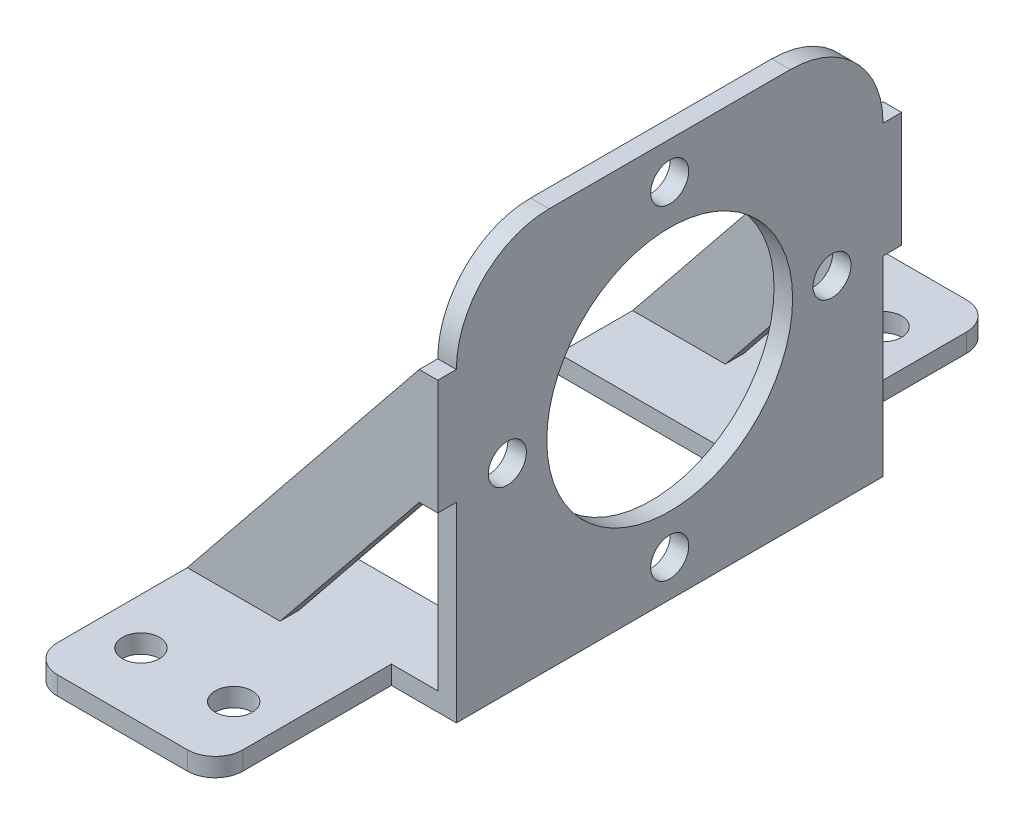
from build123d import *

# Parameters (mm, degrees)
SKETCH1_R           = 13.25
SKETCH1_R_2         = 2.05
BOSS_EXTRUDE1_DEPTH = 2
SKETCH2_R           = 2
BOSS_EXTRUDE2_DEPTH = 2
BOSS_EXTRUDE3_DEPTH = 2
BOSS_EXTRUDE4_DEPTH = 2
SKETCH5_W           = 7
SKETCH5_H           = 5
CUT_EXTRUDE1_DEPTH  = 2
SKETCH6_W           = 20
SKETCH6_H           = 5
CUT_EXTRUDE2_DEPTH  = 2
FILLET1_R           = 3
SKETCH8_W           = 25
SKETCH8_H           = 8
BOSS_EXTRUDE5_DEPTH = 2


with BuildPart() as part:
    # Sketch1 → Boss-Extrude1 (new body)
    with BuildSketch(Plane(origin=(0, 0, 0), x_dir=(0, 0, -1), z_dir=(1, 0, 0))):
        with BuildLine():
            Line((-13, 21.5), (13, 21.5))
            ThreePointArc((13, 21.5), (20.071067812, 18.571067812), (23, 11.5))
            Line((23, 11.5), (23, -21.5))
            Line((23, -21.5), (-23, -21.5))
            Line((-23, -21.5), (-23, 11.5))
            ThreePointArc((-23, 11.5), (-20.071067812, 18.571067812), (-13, 21.5))
        make_face()
        Circle(SKETCH1_R, mode=Mode.SUBTRACT)
        with Locations((0, 17.5)):
            Circle(SKETCH1_R_2, mode=Mode.SUBTRACT)
        with Locations((17.5, 0)):
            Circle(SKETCH1_R_2, mode=Mode.SUBTRACT)
        with Locations((0, -17.5)):
            Circle(SKETCH1_R_2, mode=Mode.SUBTRACT)
        with Locations((-17.5, 0)):
            Circle(SKETCH1_R_2, mode=Mode.SUBTRACT)
    extrude(amount=BOSS_EXTRUDE1_DEPTH)

    # Sketch2 → Boss-Extrude2 (add)
    # profile 1 of 2: a face of its own
    with BuildSketch(Plane.XZ.offset(21.5)):
        Polygon((-5, 23), (-25, 23), (-25, 47), (-5, 47), (-5, 28), (2, 28), (2, 23), align=None)
        with Locations(Location((-20, 35, 0), (0, 0, 270))):
            Circle(SKETCH2_R, mode=Mode.SUBTRACT)
        with Locations(Location((-10, 35, 0), (0, 0, 90))):
            Circle(SKETCH2_R, mode=Mode.SUBTRACT)
    # profile 2 of 2: a face of its own
    with BuildSketch(Plane.XZ.offset(21.5)):
        Polygon((2, -23), (-5, -23), (-25, -23), (-25, -47), (-5, -47), (-5, -28), (2, -28), align=None)
        with Locations(Location((-10, -35, 0), (0, 0, 270))):
            Circle(SKETCH2_R, mode=Mode.SUBTRACT)
        with Locations(Location((-20, -35, 0), (0, 0, 90))):
            Circle(SKETCH2_R, mode=Mode.SUBTRACT)
    extrude(amount=-BOSS_EXTRUDE2_DEPTH)

    # Sketch3 → Boss-Extrude3 (add)
    with BuildSketch(Plane(origin=(0, 0, -23), x_dir=(-1, 0, 0), z_dir=(0, 0, -1))):
        Polygon((-2, 11.5), (0, 11.5), (25, -19.5), (15, -19.5), (0, -0.9), (-2, -0.9), align=None)
    extrude(amount=BOSS_EXTRUDE3_DEPTH)

    # Sketch4 → Boss-Extrude4 (add)
    with BuildSketch(Plane.XY.offset(23)):
        Polygon((2, 11.5), (0, 11.5), (-25, -19.5), (-15, -19.5), (0, -0.9), (2, -0.9), align=None)
    extrude(amount=BOSS_EXTRUDE4_DEPTH)

    # Sketch5 → Cut-Extrude1 (cut)
    with BuildSketch(Plane.XZ.offset(21.5)):
        with Locations((-1.5, 25.5)):
            Rectangle(SKETCH5_W, SKETCH5_H)
        with Locations((-1.5, -25.5)):
            Rectangle(SKETCH5_W, SKETCH5_H)
    extrude(amount=-CUT_EXTRUDE1_DEPTH, mode=Mode.SUBTRACT)

    # Sketch6 → Cut-Extrude2 (cut)
    with BuildSketch(Plane(origin=(0, -19.5, 0), x_dir=(1, 0, 0), z_dir=(0, 1, 0))):
        with Locations((-15, 44.5)):
            Rectangle(SKETCH6_W, SKETCH6_H)
        with Locations((-15, -44.5)):
            Rectangle(SKETCH6_W, SKETCH6_H)
    extrude(amount=-CUT_EXTRUDE2_DEPTH, mode=Mode.SUBTRACT)

    # Fillet1
    fillet1_edges = [part.edges().sort_by_distance(p)[0] for p in [
        (-5, -20.5, -42),
        (-25, -20.5, -42),
        (-25, -20.5, 42),
        (-5, -20.5, 42),
    ]]
    fillet(fillet1_edges, radius=FILLET1_R)

    # Sketch8 → Boss-Extrude5 (add)
    with BuildSketch(Plane.XZ.offset(21.5)):
        with Locations((-12.5, 19)):
            Rectangle(SKETCH8_W, SKETCH8_H)
        with Locations((-12.5, -19)):
            Rectangle(SKETCH8_W, SKETCH8_H)
    extrude(amount=-BOSS_EXTRUDE5_DEPTH)


solid = part.part
